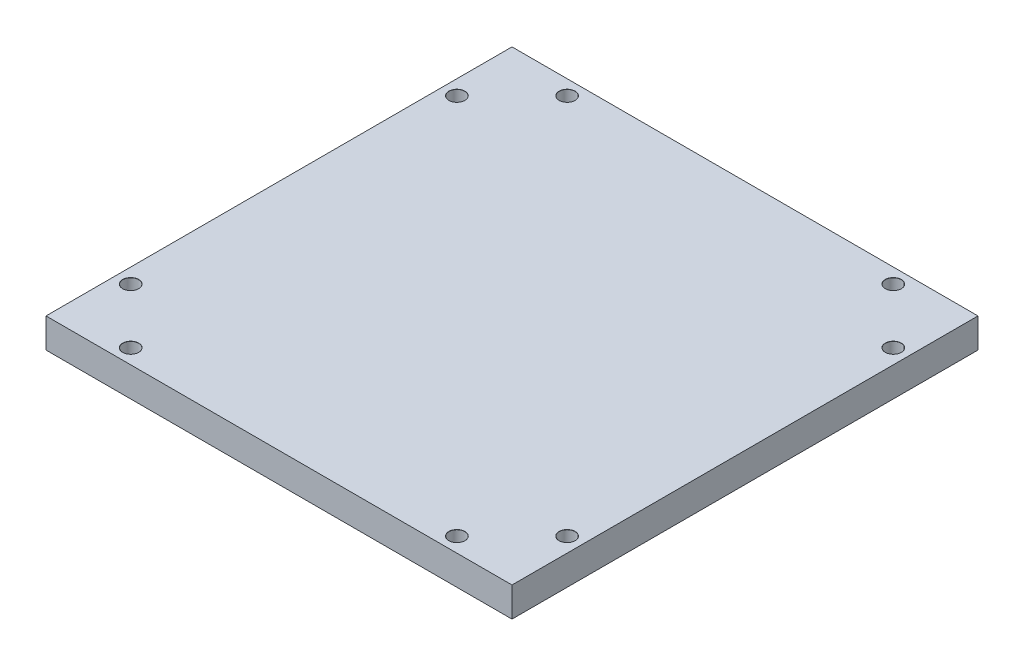
from build123d import *

# Parameters (mm, degrees)
SKETCH1_W                      = 100
SKETCH1_H                      = 100
BOSS_EXTRUDE3_DEPTH            = 6.35
M3_CLEARANCE_HOLE1_D           = 3.4
M3_CLEARANCE_HOLE1_CSINK_D     = 3.45
M3_CLEARANCE_HOLE1_CSINK_ANGLE = 90


with BuildPart() as part:
    # Sketch1 → Boss-Extrude3 (new body)
    with BuildSketch(Plane(origin=(0, 0, 0), x_dir=(1, 0, 0), z_dir=(0, 1, 0))):
        Rectangle(SKETCH1_W, SKETCH1_H)
    extrude(amount=BOSS_EXTRUDE3_DEPTH)

    # M3 Clearance Hole1 (through all)
    with Locations(Plane(origin=(0, 6.35, 0), x_dir=(1, 0, 0), z_dir=(0, 1, 0))):
        with Locations((-46.825, 35), (-35, 46.825), (35, 46.825), (46.825, 35), (46.825, -35), (35, -46.825), (-35, -46.825), (-46.825, -35)):
            CounterSinkHole(M3_CLEARANCE_HOLE1_D / 2, M3_CLEARANCE_HOLE1_CSINK_D / 2, counter_sink_angle=M3_CLEARANCE_HOLE1_CSINK_ANGLE)


solid = part.part
